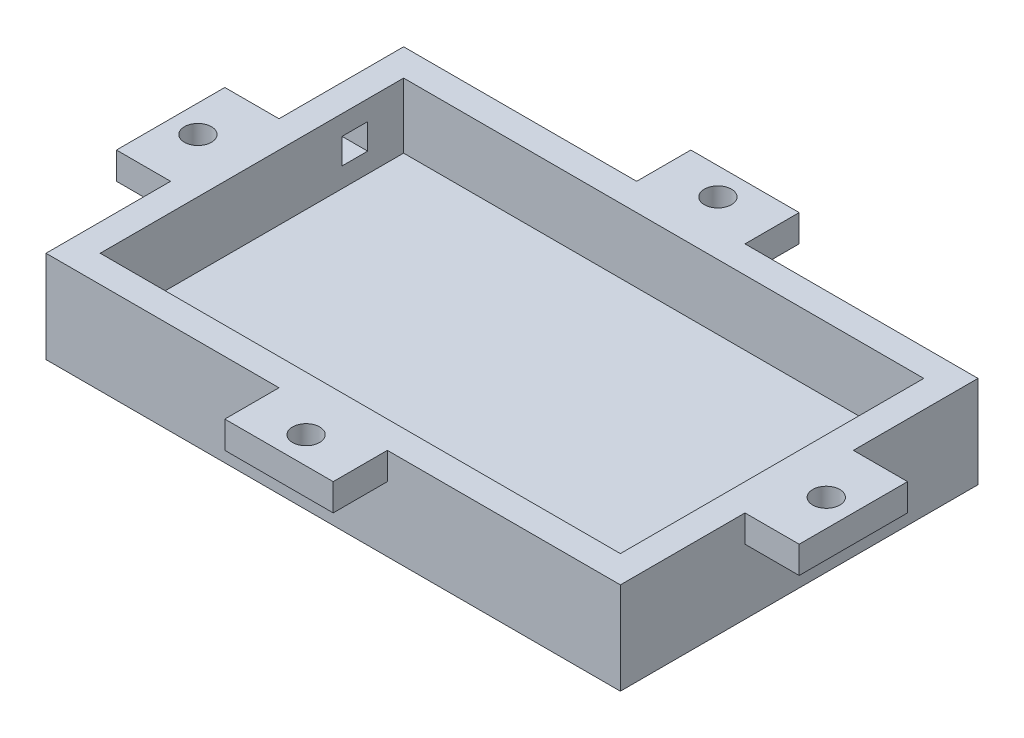
from build123d import *

# Parameters (mm, degrees)
SKETCH1_W           = 67.31
SKETCH1_H           = 41.91
BOSS_EXTRUDE5_DEPTH = 3.175
SKETCH2_W           = 67.31
SKETCH2_H           = 41.91
SKETCH2_W_2         = 60.96
SKETCH2_H_2         = 35.56
BOSS_EXTRUDE6_DEPTH = 7.62
SKETCH4_W           = 12.7
SKETCH4_H           = 6.35
SKETCH4_W_2         = 6.35
SKETCH4_H_2         = 12.7
BOSS_EXTRUDE8_DEPTH = 3.175
SKETCH6_R           = 1.5875
CUT_EXTRUDE1_DEPTH  = 50.62353348
SKETCH7_W           = 3
SKETCH7_H           = 3
CUT_EXTRUDE2_DEPTH  = 77.355944595


with BuildPart() as part:
    # Sketch1 → Boss-Extrude5 (new body)
    with BuildSketch(Plane(origin=(0, 0, 0), x_dir=(1, 0, 0), z_dir=(0, 1, 0))):
        Rectangle(SKETCH1_W, SKETCH1_H)
    extrude(amount=BOSS_EXTRUDE5_DEPTH)

    # Sketch2 → Boss-Extrude6 (add)
    with BuildSketch(Plane(origin=(0, 3.175, 0), x_dir=(1, 0, 0), z_dir=(0, 1, 0))):
        Rectangle(SKETCH2_W, SKETCH2_H)
        Rectangle(SKETCH2_W_2, SKETCH2_H_2, mode=Mode.SUBTRACT)
    extrude(amount=BOSS_EXTRUDE6_DEPTH)

    # Sketch4 → Boss-Extrude8 (add)
    with BuildSketch(Plane(origin=(0, 10.795, 0), x_dir=(1, 0, 0), z_dir=(0, 1, 0))):
        with Locations((0, -24.13)):
            Rectangle(SKETCH4_W, SKETCH4_H)
        with Locations((0, 24.13)):
            Rectangle(SKETCH4_W, SKETCH4_H)
        with Locations((36.83, 0)):
            Rectangle(SKETCH4_W_2, SKETCH4_H_2)
        with Locations((-36.83, 0)):
            Rectangle(SKETCH4_W_2, SKETCH4_H_2)
    extrude(amount=-BOSS_EXTRUDE8_DEPTH)

    # Sketch6 → Cut-Extrude1 (cut, through all)
    with BuildSketch(Plane(origin=(0, 10.795, 0), x_dir=(1, 0, 0), z_dir=(0, 1, 0))):
        with BuildLine():
            ThreePointArc((0, 25.7175), (-1.5875, 24.13), (0, 22.5425))
            Line((0, 22.5425), (0, 25.7175))
        make_face()
        with BuildLine():
            Line((0, 25.7175), (0, 22.5425))
            ThreePointArc((0, 22.5425), (1.122532015, 23.007467985), (1.5875, 24.13))
            ThreePointArc((1.5875, 24.13), (1.122532015, 25.252532015), (0, 25.7175))
        make_face()
        with Locations(Location((-36.806414665, 0, 0), (0, 0, 270))):
            Circle(SKETCH6_R)
        with Locations(Location((36.83, 0, 0), (0, 0, 270))):
            Circle(SKETCH6_R)
        with Locations(Location((0, -24.13, 0), (0, 0, 270))):
            Circle(SKETCH6_R)
    extrude(amount=-CUT_EXTRUDE1_DEPTH, mode=Mode.SUBTRACT)

    # Sketch7 → Cut-Extrude2 (cut, through all)
    with BuildSketch(Plane(origin=(-30.48, 0, 0), x_dir=(0, 0, -1), z_dir=(1, 0, 0))):
        with Locations((12.065620766, 6.985)):
            Rectangle(SKETCH7_W, SKETCH7_H)
    extrude(amount=-CUT_EXTRUDE2_DEPTH, mode=Mode.SUBTRACT)


solid = part.part
